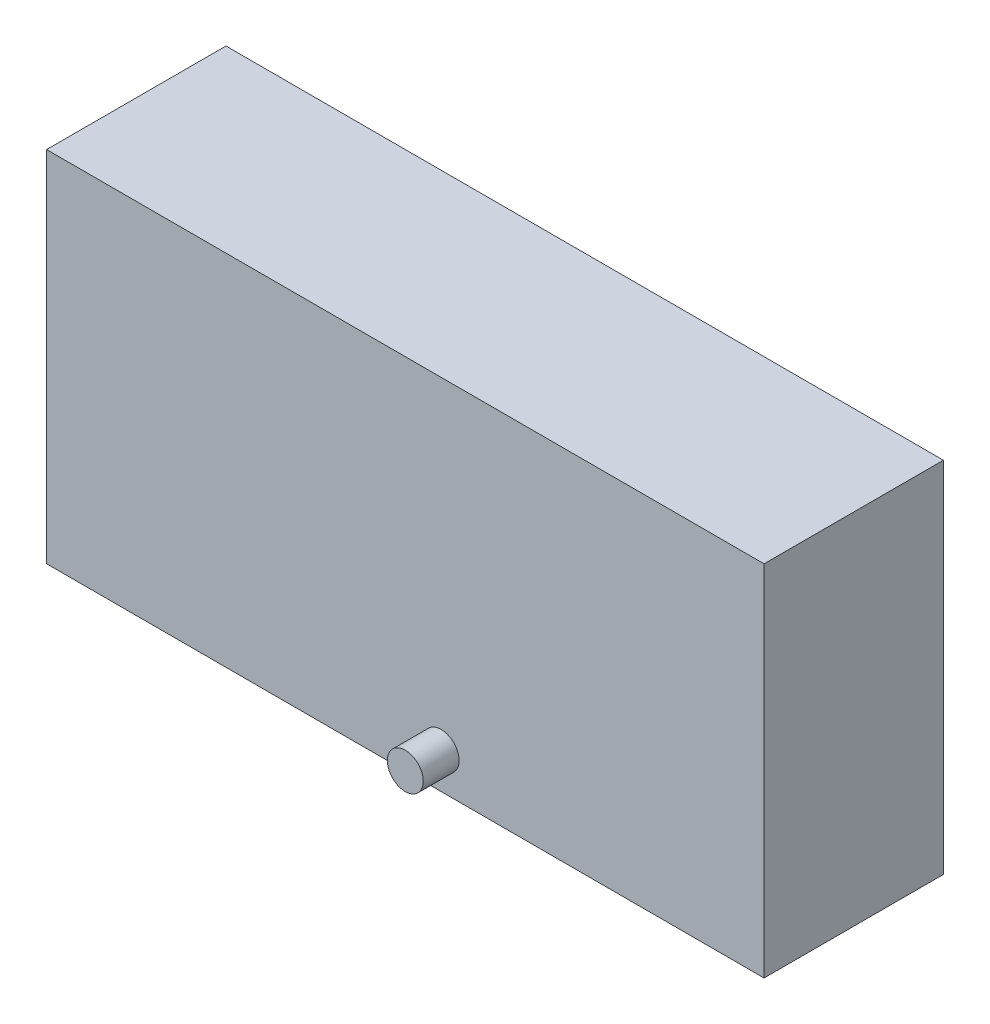
from build123d import *

# Parameters (mm, degrees)
SKETCH_1_W     = 20
SKETCH_1_H     = 20
BASEBOX_DEPTH  = 10
SKETCH_2_R     = 1
BOSSSEED_DEPTH = 2


with BuildPart() as part:
    # 草图1 → BaseBox (new body)
    with BuildSketch(Plane.XY):
        with Locations((10, 10)):
            Rectangle(SKETCH_1_W, SKETCH_1_H)
    basebox = extrude(amount=BASEBOX_DEPTH)

    # 草图2 → BossSeed (add)
    with BuildSketch(Plane.XY.offset(10)):
        with Locations((2, 2)):
            Circle(SKETCH_2_R)
    extrude(amount=BOSSSEED_DEPTH)

    # Mirror 2: BaseBox across plane
    add(basebox.mirror(Plane(origin=(0, 0, 0), x_dir=(0, 0, 1), z_dir=(1, 0, 0))))


solid = part.part
